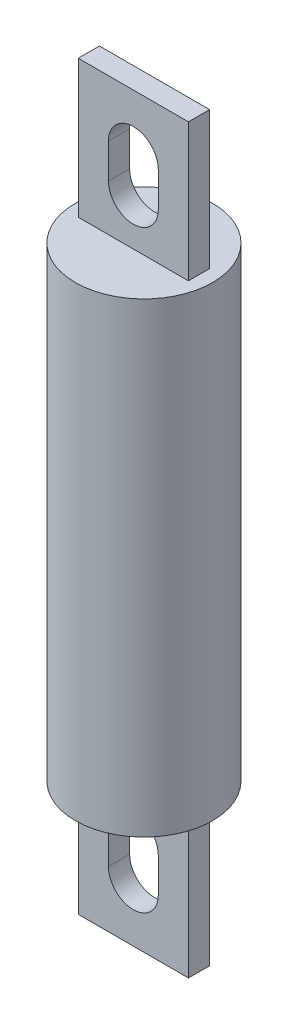
from build123d import *

# Parameters (mm, degrees)
SKETCH1_R           = 10.287
BOSS_EXTRUDE1_DEPTH = 69.85
SKETCH2_W           = 16.51
SKETCH2_H           = 3.175
BOSS_EXTRUDE2_DEPTH = 20.6375
CUT_EXTRUDE1_DEPTH  = 92.841242236


with BuildPart() as part:
    # Sketch1 → Boss-Extrude1 (new body)
    with BuildSketch(Plane(origin=(0, 0, 0), x_dir=(1, 0, 0), z_dir=(0, 1, 0))):
        with Locations(Location((0, 0, 0), (0, 0, 270))):
            Circle(SKETCH1_R)
    extrude(amount=BOSS_EXTRUDE1_DEPTH)

    # Sketch2 → Boss-Extrude2 (add)
    with BuildSketch(Plane(origin=(0, 69.85, 0), x_dir=(1, 0, 0), z_dir=(0, 1, 0))):
        Rectangle(SKETCH2_W, SKETCH2_H)
    boss_extrude2 = extrude(amount=BOSS_EXTRUDE2_DEPTH)

    # Sketch3 → Cut-Extrude1 (cut, through all)
    with BuildSketch(Plane.XY.offset(1.5875)):
        with BuildLine():
            Line((3.7338, 82.0166), (3.7338, 76.8096))
            ThreePointArc((3.7338, 76.8096), (0, 73.0758), (-3.7338, 76.8096))
            Line((-3.7338, 76.8096), (-3.7338, 82.0166))
            ThreePointArc((-3.7338, 82.0166), (0, 85.7504), (3.7338, 82.0166))
        make_face()
    cut_extrude1 = extrude(amount=-CUT_EXTRUDE1_DEPTH, mode=Mode.SUBTRACT)

    # Mirror2: Boss-Extrude2, Cut-Extrude1 across plane
    add(boss_extrude2.mirror(Plane.ZX.offset(34.925)))
    add(cut_extrude1.mirror(Plane.ZX.offset(34.925)), mode=Mode.SUBTRACT)


solid = part.part
